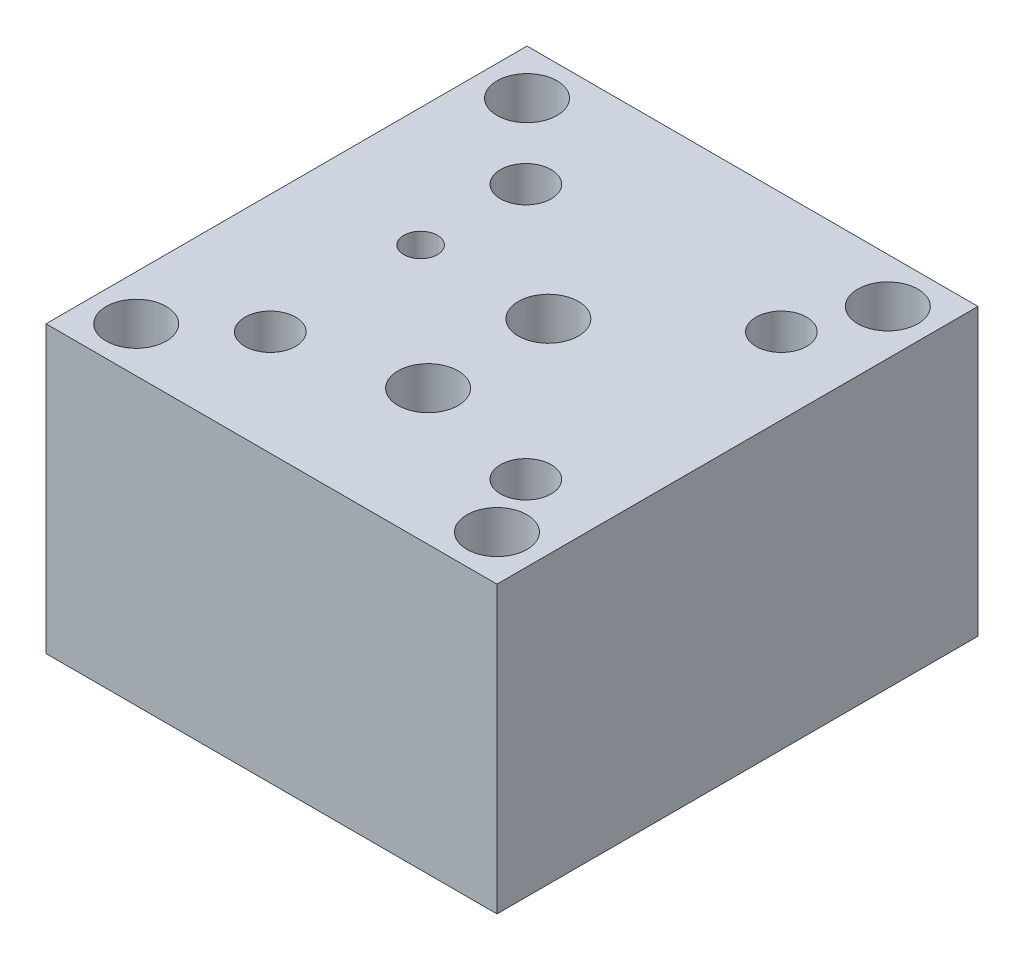
from build123d import *

# Parameters (mm, degrees)
SKETCH1_W           = 95.25
SKETCH1_H           = 101.6
BOSS_EXTRUDE1_DEPTH = 30.1625
CUT_EXTRUDE2_START  = 30.1625
SKETCH2_R           = 4.3688
CUT_EXTRUDE2_DEPTH  = 101.6
CUT_EXTRUDE4_START  = 30.1625
SKETCH3_R           = 6.35
CUT_EXTRUDE4_DEPTH  = 25.4
CUT_EXTRUDE6_START  = 30.1625
SKETCH4_R           = 5.3578125
CUT_EXTRUDE6_DEPTH  = 20.32
CUT_EXTRUDE8_START  = 30.1625
SKETCH5_R           = 6.35
CUT_EXTRUDE8_DEPTH  = 45.72
CUT_EXTRUDE10_START = 30.1625
SKETCH6_R           = 3.556
CUT_EXTRUDE10_DEPTH = 7.9375
CUT_EXTRUDE12_START = -47.625
SKETCH7_R           = 5.55625
CUT_EXTRUDE12_DEPTH = 53.34
CUT_EXTRUDE14_START = -50.8
SKETCH8_R           = 5.55625
CUT_EXTRUDE14_DEPTH = 53.34
CUT_EXTRUDE16_START = -30.1625
SKETCH9_R           = 6.35
CUT_EXTRUDE16_DEPTH = 27.94
CUT_EXTRUDE18_START = -30.1625
SKETCH10_R          = 12.7127
CUT_EXTRUDE18_DEPTH = 3.1242


with BuildPart() as part:
    # Sketch1 → Boss-Extrude1 (new, symmetric)
    with BuildSketch(Plane(origin=(0, 0, 0), x_dir=(1, 0, 0), z_dir=(0, 1, 0))):
        Rectangle(SKETCH1_W, SKETCH1_H)
    extrude(amount=BOSS_EXTRUDE1_DEPTH, both=True)

    # Sketch2 → Cut-Extrude2 (cut)
    with BuildSketch(Plane(origin=(0, 0, 0), x_dir=(1, 0, 0), z_dir=(0, 1, 0)).offset(CUT_EXTRUDE2_START)):
        with Locations(Location((-38.1, -41.275, 0), (0, 0, 270))):
            Circle(SKETCH2_R)
        with Locations(Location((38.1, -41.275, 0), (0, 0, 270))):
            Circle(SKETCH2_R)
        with Locations(Location((-38.1, 41.275, 0), (0, 0, 270))):
            Circle(SKETCH2_R)
        with Locations(Location((38.1, 41.275, 0), (0, 0, 270))):
            Circle(SKETCH2_R)
    extrude(amount=-CUT_EXTRUDE2_DEPTH, mode=Mode.SUBTRACT)

    # Sketch3 → Cut-Extrude4 (cut)
    with BuildSketch(Plane(origin=(0, 0, 0), x_dir=(1, 0, 0), z_dir=(0, 1, 0)).offset(CUT_EXTRUDE4_START)):
        with Locations(Location((-38.1, -41.275, 0), (0, 0, 270))):
            Circle(SKETCH3_R)
        with Locations(Location((38.1, -41.275, 0), (0, 0, 270))):
            Circle(SKETCH3_R)
        with Locations(Location((-38.1, 41.275, 0), (0, 0, 270))):
            Circle(SKETCH3_R)
        with Locations(Location((38.1, 41.275, 0), (0, 0, 270))):
            Circle(SKETCH3_R)
    extrude(amount=-CUT_EXTRUDE4_DEPTH, mode=Mode.SUBTRACT)

    # Sketch4 → Cut-Extrude6 (cut)
    with BuildSketch(Plane(origin=(0, 0, 0), x_dir=(1, 0, 0), z_dir=(0, 1, 0)).offset(CUT_EXTRUDE6_START)):
        with Locations(Location((-22.479, -28.575, 0), (0, 0, 270))):
            Circle(SKETCH4_R)
        with Locations(Location((31.496, -28.575, 0), (0, 0, 270))):
            Circle(SKETCH4_R)
        with Locations(Location((-22.479, 25.4, 0), (0, 0, 270))):
            Circle(SKETCH4_R)
        with Locations(Location((31.496, 25.4, 0), (0, 0, 270))):
            Circle(SKETCH4_R)
    extrude(amount=-CUT_EXTRUDE6_DEPTH, mode=Mode.SUBTRACT)

    # Sketch5 → Cut-Extrude8 (cut)
    with BuildSketch(Plane(origin=(0, 0, 0), x_dir=(1, 0, 0), z_dir=(0, 1, 0)).offset(CUT_EXTRUDE8_START)):
        with Locations(Location((4.5085, -22.225, 0), (0, 0, 270))):
            Circle(SKETCH5_R)
        with Locations(Location((4.5085, 3.175, 0), (0, 0, 270))):
            Circle(SKETCH5_R)
    extrude(amount=-CUT_EXTRUDE8_DEPTH, mode=Mode.SUBTRACT)

    # Sketch6 → Cut-Extrude10 (cut)
    with BuildSketch(Plane(origin=(0, 0, 0), x_dir=(1, 0, 0), z_dir=(0, 1, 0)).offset(CUT_EXTRUDE10_START)):
        with Locations(Location((-22.479, 3.175, 0), (0, 0, 270))):
            Circle(SKETCH6_R)
    extrude(amount=-CUT_EXTRUDE10_DEPTH, mode=Mode.SUBTRACT)

    # Sketch7 → Cut-Extrude12 (cut)
    with BuildSketch(Plane(origin=(0, 0, 0), x_dir=(0, 0, -1), z_dir=(1, 0, 0)).offset(CUT_EXTRUDE12_START)):
        with Locations(Location((-16.637, -11.1125, 0), (0, 0, 233.130102354))):
            Circle(SKETCH7_R)
    extrude(amount=CUT_EXTRUDE12_DEPTH, mode=Mode.SUBTRACT)

    # Sketch8 → Cut-Extrude14 (cut)
    with BuildSketch(Plane.XY.offset(CUT_EXTRUDE14_START)):
        with Locations(Location((10.16, -11.1125, 0), (0, 0, 233.130102354))):
            Circle(SKETCH8_R)
    extrude(amount=CUT_EXTRUDE14_DEPTH, mode=Mode.SUBTRACT)

    # Sketch9 → Cut-Extrude16 (cut)
    with BuildSketch(Plane(origin=(0, 0, 0), x_dir=(1, 0, 0), z_dir=(0, 1, 0)).offset(CUT_EXTRUDE16_START)):
        with Locations(Location((-28.575, -11.1125, 0), (0, 0, 270))):
            Circle(SKETCH9_R)
        with Locations(Location((15.875, 30.1625, 0), (0, 0, 270))):
            Circle(SKETCH9_R)
    extrude(amount=CUT_EXTRUDE16_DEPTH, mode=Mode.SUBTRACT)

    # Sketch10 → Cut-Extrude18 (cut)
    with BuildSketch(Plane(origin=(0, 0, 0), x_dir=(1, 0, 0), z_dir=(0, 1, 0)).offset(CUT_EXTRUDE18_START)):
        with Locations(Location((-28.575, -11.1125, 0), (0, 0, 270))):
            Circle(SKETCH10_R)
        with Locations(Location((15.875, 30.1625, 0), (0, 0, 270))):
            Circle(SKETCH10_R)
    extrude(amount=CUT_EXTRUDE18_DEPTH, mode=Mode.SUBTRACT)


solid = part.part
